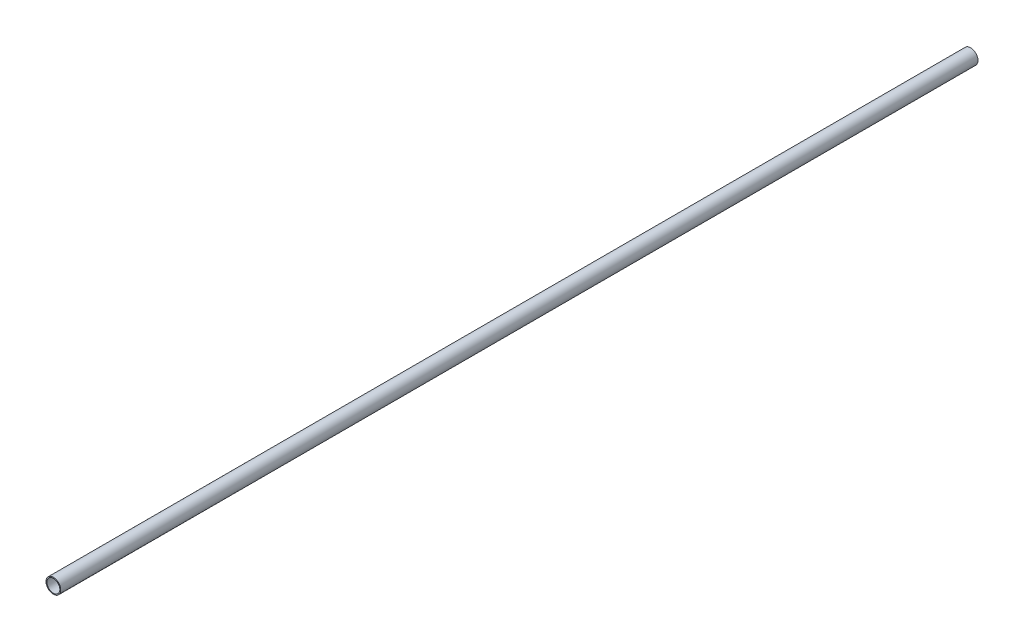
from build123d import *

# Parameters (mm, degrees)
SKETCH2_R           = 24.125
SKETCH2_R_2         = 21.075
BOSS_EXTRUDE1_DEPTH = 3000


with BuildPart() as part:
    # Sketch2 → Boss-Extrude1 (new body)
    with BuildSketch(Plane.XY):
        with Locations((2449.72011288, -5187.007415734)):
            Circle(SKETCH2_R)
        with Locations((2449.72011288, -5187.007415734)):
            Circle(SKETCH2_R_2, mode=Mode.SUBTRACT)
    extrude(amount=BOSS_EXTRUDE1_DEPTH)


solid = part.part
